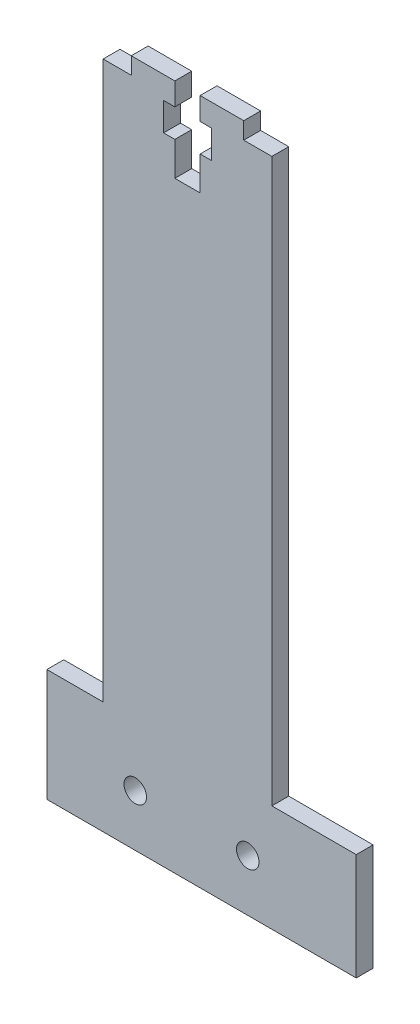
from build123d import *

# Parameters (mm, degrees)
SKETCH_1_W               = 10
SKETCH_1_H               = 20
SKETCH_1_W_2             = 15
SKETCH_1_H_2             = 19
SKETCH_1_W_3             = 7.75
SKETCH_1_H_3             = 3
EXTRUDE_1_DEPTH          = 3
CUT_EXTRUDE_1_DEPTH      = 70.392002421
CUT_EXTRUDE_1_DEPTH_BACK = 70.392002421
SKETCH_2_R               = 2


with BuildPart() as part:
    # 草图1 → 凸台-拉伸1 (new body)
    with BuildSketch(Plane.XY):
        with Locations((-20, -49.5)):
            Rectangle(SKETCH_1_W, SKETCH_1_H)
        with Locations((22.5, -50)):
            Rectangle(SKETCH_1_W_2, SKETCH_1_H_2)
        Polygon((-2.25, 58.5), (-2.25, 59.5), (-10, 59.5), (-15, 59.5), (-15, -39.5), (-15, -59.5), (15, -59.5), (15, -40.5), (15, 59.5), (10, 59.5), (2.25, 59.5), (2.25, 58.5), (4.25, 58.5), (4.25, 53.5), (2.25, 53.5), (2.25, 47.5), (-2.25, 47.5), (-2.25, 53.5), (-4.25, 53.5), (-4.25, 58.5), align=None)
        with Locations((6.125, 61)):
            Rectangle(SKETCH_1_W_3, SKETCH_1_H_3)
        with Locations((-6.125, 61)):
            Rectangle(SKETCH_1_W_3, SKETCH_1_H_3)
    extrude(amount=EXTRUDE_1_DEPTH)

    # 草图2 → 切除-拉伸1 (cut, two sides: drawn at the far end of the back side and taken through both)
    with BuildSketch(Plane.XY.offset(3).offset(-CUT_EXTRUDE_1_DEPTH_BACK)):
        with Locations((-9.288837026, -50.295936885)):
            Circle(SKETCH_2_R)
        with Locations((10.711162974, -50.295936885)):
            Circle(SKETCH_2_R)
    extrude(amount=CUT_EXTRUDE_1_DEPTH + CUT_EXTRUDE_1_DEPTH_BACK, mode=Mode.SUBTRACT)


solid = part.part
